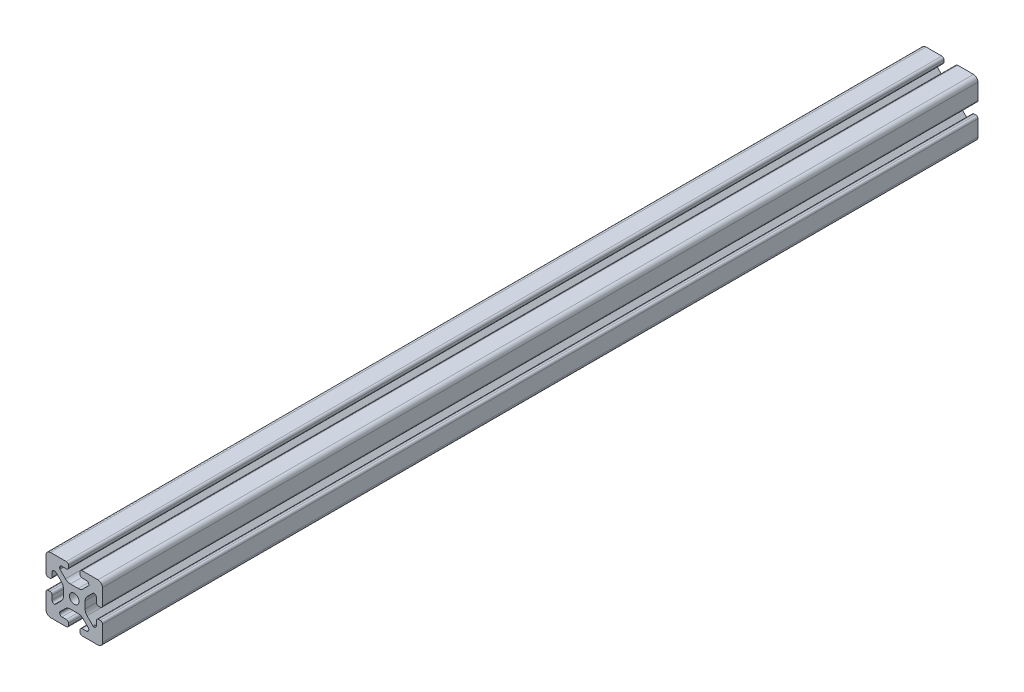
from build123d import *

# Parameters (mm, degrees)
SKETCH1_R      = 3.4
EXTRUDE1_DEPTH = 620


with BuildPart() as part:
    # Sketch1 → Extrude1 (new body)
    with BuildSketch(Plane.XY):
        with BuildLine():
            Line((-8.715, -15.524615034), (-5.63, -15.524615034))
            ThreePointArc((-5.63, -15.524615034), (-4.519842354, -15.984457388), (-4.06, -17.094615034))
            Line((-4.06, -17.094615034), (-4.06, -18.43))
            ThreePointArc((-4.06, -18.43), (-4.519842354, -19.540157646), (-5.63, -20))
            Line((-5.63, -20), (-16.674615034, -20))
            ThreePointArc((-16.674615034, -20), (-18.951578385, -19.194274381), (-20, -17.018368134))
            Line((-20, -17.018368134), (-20, -5.757918808))
            ThreePointArc((-20, -5.757918808), (-19.564709668, -4.603883664), (-18.43, -4.120449326))
            Line((-18.43, -4.120449326), (-17.25, -4.120449326))
            ThreePointArc((-17.25, -4.120449326), (-16.115287682, -4.60388249), (-15.67999625, -5.757919334))
            Line((-15.67999625, -5.757919334), (-15.67999625, -8.715399492))
            ThreePointArc((-15.67999625, -8.715399492), (-15.220153896, -9.825557139), (-14.10999625, -10.285399492))
            Line((-14.10999625, -10.285399492), (-13.816898819, -10.285399492))
            ThreePointArc((-13.816898819, -10.285399492), (-13.526061711, -10.227547119), (-13.279501941, -10.062800646))
            Line((-13.279501941, -10.062800646), (-9.076242789, -5.859541495))
            ThreePointArc((-9.076242789, -5.859541495), (-8.046572221, -4.318530588), (-7.685, -2.500784284))
            Line((-7.685, -2.500784284), (-7.685, 2.500784284))
            ThreePointArc((-7.685, 2.500784284), (-8.046572221, 4.318530588), (-9.076242789, 5.859541495))
            Line((-9.076242789, 5.859541495), (-13.040489136, 9.823787841))
            ThreePointArc((-13.040489136, 9.823787841), (-13.354224618, 10.012729352), (-13.71989919, 10.033001362))
            Line((-13.71989919, 10.033001362), (-14.05520779, 10.044710596))
            ThreePointArc((-14.05520779, 10.044710596), (-15.200613642, 9.605030484), (-15.68, 8.475666998))
            Line((-15.68, 8.475666998), (-15.68, 5.572979049))
            ThreePointArc((-15.68, 5.572979049), (-16.139842354, 4.462821403), (-17.25, 4.002979049))
            Line((-17.25, 4.002979049), (-18.43, 4.002979049))
            ThreePointArc((-18.43, 4.002979049), (-19.540157646, 4.462821403), (-20, 5.572979049))
            Line((-20, 5.572979049), (-20, 13.004526564))
            Line((-20, 13.004526564), (-20, 16.83))
            ThreePointArc((-20, 16.83), (-19.071528496, 19.071528496), (-16.83, 20))
            Line((-16.83, 20), (-5.63, 20))
            ThreePointArc((-5.63, 20), (-4.519842354, 19.540157646), (-4.06, 18.43))
            Line((-4.06, 18.43), (-4.06, 17.094615034))
            ThreePointArc((-4.06, 17.094615034), (-4.519842354, 15.984457388), (-5.63, 15.524615034))
            Line((-5.63, 15.524615034), (-8.715, 15.524615034))
            ThreePointArc((-8.715, 15.524615034), (-9.825157646, 15.06477268), (-10.285, 13.954615034))
            Line((-10.285, 13.954615034), (-10.285, 13.492503602))
            ThreePointArc((-10.285, 13.492503602), (-10.227148445, 13.201664194), (-10.062401154, 12.955102448))
            Line((-10.062401154, 12.955102448), (-6.217092793, 9.109794088))
            ThreePointArc((-6.217092793, 9.109794088), (-4.63891877, 8.055291919), (-2.777335583, 7.685))
            Line((-2.777335583, 7.685), (2.777335583, 7.685))
            ThreePointArc((2.777335583, 7.685), (4.63891877, 8.055291919), (6.217092793, 9.109794088))
            Line((6.217092793, 9.109794088), (10.062401154, 12.955102448))
            ThreePointArc((10.062401154, 12.955102448), (10.227148445, 13.201664194), (10.285, 13.492503602))
            Line((10.285, 13.492503602), (10.285, 13.954615034))
            ThreePointArc((10.285, 13.954615034), (9.825157646, 15.06477268), (8.715, 15.524615034))
            Line((8.715, 15.524615034), (5.63, 15.524615034))
            ThreePointArc((5.63, 15.524615034), (4.519842354, 15.984457388), (4.06, 17.094615034))
            Line((4.06, 17.094615034), (4.06, 18.43))
            ThreePointArc((4.06, 18.43), (4.519842354, 19.540157646), (5.63, 20))
            Line((5.63, 20), (12.979635074, 20))
            Line((12.979635074, 20), (16.83, 20))
            ThreePointArc((16.83, 20), (19.071528496, 19.071528496), (20, 16.83))
            Line((20, 16.83), (20, 13.001098436))
            Line((20, 13.001098436), (20, 5.63))
            ThreePointArc((20, 5.63), (19.540157461, 4.519842693), (18.43, 4.060000526))
            Line((18.43, 4.060000526), (17.24999625, 4.060000526))
            ThreePointArc((17.24999625, 4.060000526), (16.139838603, 4.519842879), (15.67999625, 5.630000526))
            Line((15.67999625, 5.630000526), (15.67999625, 8.715399492))
            ThreePointArc((15.67999625, 8.715399492), (15.220153896, 9.825557139), (14.10999625, 10.285399492))
            Line((14.10999625, 10.285399492), (13.816903094, 10.285399492))
            ThreePointArc((13.816903094, 10.285399492), (13.526063686, 10.227547937), (13.279501941, 10.062800646))
            Line((13.279501941, 10.062800646), (9.076242789, 5.859541495))
            ThreePointArc((9.076242789, 5.859541495), (8.046572221, 4.318530588), (7.685, 2.500784284))
            Line((7.685, 2.500784284), (7.685, -2.500784284))
            ThreePointArc((7.685, -2.500784284), (8.046572221, -4.318530588), (9.076242789, -5.859541495))
            Line((9.076242789, -5.859541495), (13.163657296, -9.946956002))
            ThreePointArc((13.163657296, -9.946956002), (13.35903797, -10.160433474), (13.6200547, -10.285399492))
            Line((13.6200547, -10.285399492), (14.10999625, -10.285399492))
            ThreePointArc((14.10999625, -10.285399492), (15.220153896, -9.825557139), (15.67999625, -8.715399492))
            Line((15.67999625, -8.715399492), (15.67999625, -5.630000526))
            ThreePointArc((15.67999625, -5.630000526), (16.139838603, -4.519842879), (17.24999625, -4.060000526))
            Line((17.24999625, -4.060000526), (18.43, -4.060000526))
            ThreePointArc((18.43, -4.060000526), (19.540157461, -4.519842693), (20, -5.63))
            Line((20, -5.63), (20, -16.83))
            ThreePointArc((20, -16.83), (19.071528496, -19.071528496), (16.83, -20))
            Line((16.83, -20), (13, -20))
            Line((13, -20), (5.63, -20))
            ThreePointArc((5.63, -20), (4.519842354, -19.540157646), (4.06, -18.43))
            Line((4.06, -18.43), (4.06, -17.094615034))
            ThreePointArc((4.06, -17.094615034), (4.519842354, -15.984457388), (5.63, -15.524615034))
            Line((5.63, -15.524615034), (8.715, -15.524615034))
            ThreePointArc((8.715, -15.524615034), (9.825157646, -15.06477268), (10.285, -13.954615034))
            Line((10.285, -13.954615034), (10.285, -13.492503602))
            ThreePointArc((10.285, -13.492503602), (10.227148445, -13.201664194), (10.062401154, -12.955102448))
            Line((10.062401154, -12.955102448), (6.217092793, -9.109794088))
            ThreePointArc((6.217092793, -9.109794088), (4.63891877, -8.055291919), (2.777335583, -7.685))
            Line((2.777335583, -7.685), (-2.777335583, -7.685))
            ThreePointArc((-2.777335583, -7.685), (-4.63891877, -8.055291919), (-6.217092793, -9.109794088))
            Line((-6.217092793, -9.109794088), (-10.062401154, -12.955102448))
            ThreePointArc((-10.062401154, -12.955102448), (-10.227148445, -13.201664194), (-10.285, -13.492503602))
            Line((-10.285, -13.492503602), (-10.285, -13.954615034))
            ThreePointArc((-10.285, -13.954615034), (-9.825157646, -15.06477268), (-8.715, -15.524615034))
        make_face()
        Circle(SKETCH1_R, mode=Mode.SUBTRACT)
    extrude(amount=-EXTRUDE1_DEPTH)


solid = part.part
